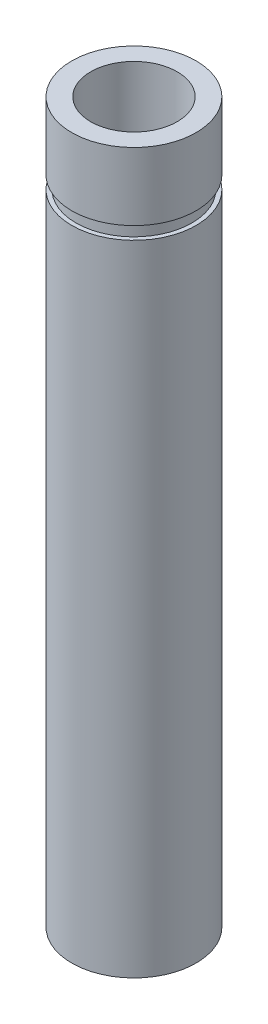
from build123d import *

# Parameters (mm, degrees)
SKETCH12_R                 = 16
SKETCH12_R_2               = 10.23
MIEMBRO_ESTRUCTURAL1_DEPTH = 170
CROQUIS2_W                 = 15.159083904
CROQUIS2_H                 = 170
CROQUIS3_W                 = 1
CROQUIS3_H                 = 3


with BuildPart() as part:
    # Sketch12 → Miembro estructural1 (new body)
    with BuildSketch(Plane(origin=(-13.919870477, -136.5234375, 0), x_dir=(-1, 0, 0), z_dir=(0, 1, 0))):
        Circle(SKETCH12_R)
        Circle(SKETCH12_R_2, mode=Mode.SUBTRACT)
    extrude(amount=MIEMBRO_ESTRUCTURAL1_DEPTH)

    # Croquis2 → Cortar-Revolución1 (revolve, cut)
    with BuildSketch(Plane.XY, mode=Mode.PRIVATE) as cortar_revoluci_n1_sk:
        with Locations((8.359671475, -51.5234375)):
            Rectangle(CROQUIS2_W, CROQUIS2_H)
    revolve(cortar_revoluci_n1_sk.sketch.rotate(Axis((-13.919870477, 33.4765625, 0), (0, -1, 0)), 90), axis=Axis((-13.919870477, 33.4765625, 0), (0, -1, 0)), mode=Mode.SUBTRACT)

    # Croquis3 → Cortar-Revolución2 (revolve, cut)
    with BuildSketch(Plane.XY, mode=Mode.PRIVATE) as cortar_revoluci_n2_sk:
        with Locations((0.280129523, 15.9765625)):
            Rectangle(CROQUIS3_W, CROQUIS3_H)
    revolve(cortar_revoluci_n2_sk.sketch.rotate(Axis((-13.919870477, 33.4765625, 0), (0, -1, 0)), 180), axis=Axis((-13.919870477, 33.4765625, 0), (0, -1, 0)), mode=Mode.SUBTRACT)


solid = part.part
